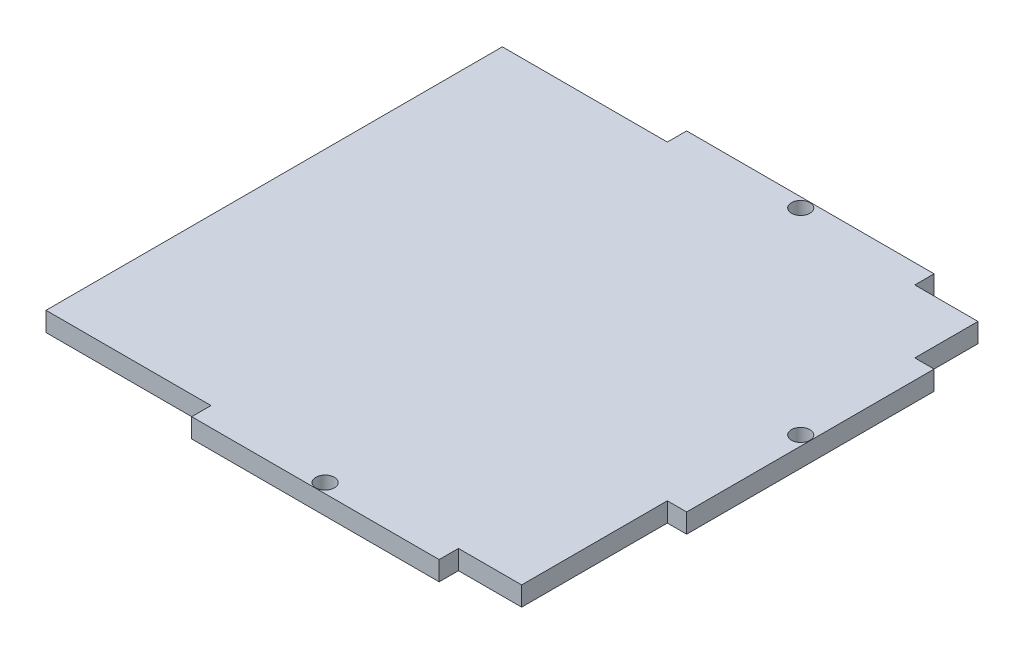
from build123d import *

# Parameters (mm, degrees)
SKETCH1_W           = 76.2
SKETCH1_H           = 76.2
BOSS_EXTRUDE1_DEPTH = 2.9718
SKETCH2_W           = 25.4
SKETCH2_H           = 2.9718
SKETCH2_W_2         = 12.7
SKETCH2_W_3         = 2.9718
SKETCH2_H_2         = 12.7
SKETCH2_H_3         = 25.4
SKETCH2_R           = 1.4224
CUT_EXTRUDE1_DEPTH  = 54.963428313


with BuildPart() as part:
    # Sketch1 → Boss-Extrude1 (new body)
    with BuildSketch(Plane(origin=(0, 0, 0), x_dir=(1, 0, 0), z_dir=(0, 1, 0))):
        Rectangle(SKETCH1_W, SKETCH1_H)
    extrude(amount=BOSS_EXTRUDE1_DEPTH)

    # Sketch2 → Cut-Extrude1 (cut, through all)
    with BuildSketch(Plane(origin=(0, 2.9718, 0), x_dir=(1, 0, 0), z_dir=(0, 1, 0))):
        with Locations((-25.4, 36.6141)):
            Rectangle(SKETCH2_W, SKETCH2_H)
        with Locations((31.75, 36.6141)):
            Rectangle(SKETCH2_W_2, SKETCH2_H)
        with Locations((36.6141, 31.75)):
            Rectangle(SKETCH2_W_3, SKETCH2_H_2)
        with Locations((36.6141, -25.4)):
            Rectangle(SKETCH2_W_3, SKETCH2_H_3)
        with Locations(Location((36.6141, 6.35, 0), (0, 0, 270))):
            Circle(SKETCH2_R)
        with Locations(Location((6.35, 36.6141, 0), (0, 0, 270))):
            Circle(SKETCH2_R)
        with Locations((31.75, -36.6141)):
            Rectangle(SKETCH2_W_2, SKETCH2_H)
        with Locations(Location((6.35, -36.6141, 0), (0, 0, 270))):
            Circle(SKETCH2_R)
        with Locations((-25.4, -36.6141)):
            Rectangle(SKETCH2_W, SKETCH2_H)
    extrude(amount=-CUT_EXTRUDE1_DEPTH, mode=Mode.SUBTRACT)


solid = part.part
